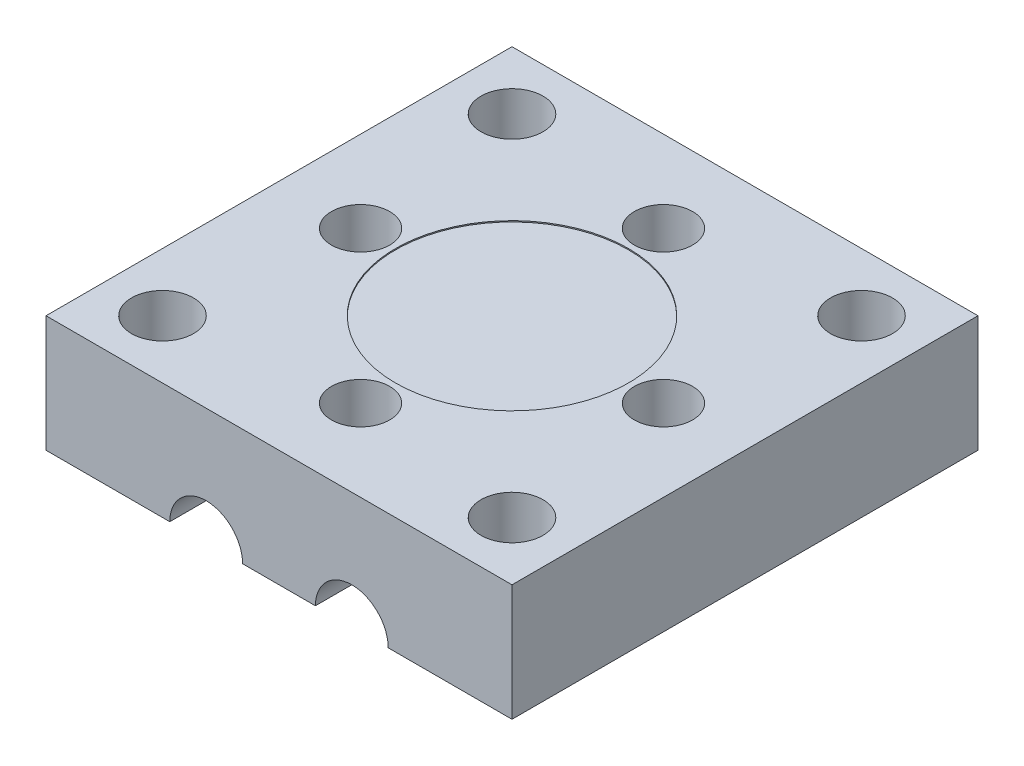
from build123d import *

# Parameters (mm, degrees)
SKETCH1_W               = 50.8
SKETCH1_H               = 50.8
BOSS_EXTRUDE1_DEPTH     = 12.7
SKETCH2_R               = 3.96875
CUT_EXTRUDE1_DEPTH      = 59.198711326
F_1_4_CLEARANCE_HOLE1_D = 6.7564
SKETCH7_R               = 3.175
CUT_EXTRUDE2_DEPTH      = 6.35
F_6_CLEARANCE_HOLE1_D   = 3.7973
CUT_EXTRUDE5_START      = -1.5875
SKETCH15_R              = 3.175
CUT_EXTRUDE5_DEPTH      = 1.5875
SKETCH16_R              = 12.7
CUT_EXTRUDE6_DEPTH      = 0.127


with BuildPart() as part:
    # Sketch1 → Boss-Extrude1 (new body)
    with BuildSketch(Plane(origin=(0, 0, 0), x_dir=(1, 0, 0), z_dir=(0, 1, 0))):
        Rectangle(SKETCH1_W, SKETCH1_H)
    extrude(amount=BOSS_EXTRUDE1_DEPTH)

    # Sketch2 → Cut-Extrude1 (cut, through all)
    with BuildSketch(Plane.XY.offset(25.4)):
        with Locations((-7.9375, 0)):
            Circle(SKETCH2_R)
        with Locations((7.9375, 0)):
            Circle(SKETCH2_R)
    extrude(amount=-CUT_EXTRUDE1_DEPTH, mode=Mode.SUBTRACT)

    # 1/4 Clearance Hole1 (through all)
    with Locations(Plane(origin=(0, 12.7, 0), x_dir=(1, 0, 0), z_dir=(0, 1, 0))):
        with Locations((-19.05, -19.05), (-19.05, 19.05), (19.05, 19.05), (19.05, -19.05)):
            Hole(F_1_4_CLEARANCE_HOLE1_D / 2)

    # Sketch7 → Cut-Extrude2 (cut)
    with BuildSketch(Plane(origin=(0, 12.7, 0), x_dir=(1, 0, 0), z_dir=(0, 1, 0))):
        with Locations(Location((-16.51, 0, 0), (0, 0, 270))):
            Circle(SKETCH7_R)
        with Locations(Location((0, 16.51, 0), (0, 0, 270))):
            Circle(SKETCH7_R)
        with Locations(Location((16.51, 0, 0), (0, 0, 270))):
            Circle(SKETCH7_R)
        with Locations(Location((0, -16.51, 0), (0, 0, 270))):
            Circle(SKETCH7_R)
    extrude(amount=-CUT_EXTRUDE2_DEPTH, mode=Mode.SUBTRACT)

    # #6 Clearance Hole1 (through all)
    with Locations(Plane(origin=(0, 6.35, 0), x_dir=(1, 0, 0), z_dir=(0, 1, 0))):
        with Locations((-16.51, 0), (0, 16.51), (16.51, 0), (0, -16.51)):
            Hole(F_6_CLEARANCE_HOLE1_D / 2)

    # Sketch15 → Cut-Extrude5 (cut)
    with BuildSketch(Plane.XZ.offset(CUT_EXTRUDE5_START)):
        with Locations(Location((0, 16.51, 0), (0, 0, 90))):
            Circle(SKETCH15_R)
        with Locations(Location((16.51, 0, 0), (0, 0, 90))):
            Circle(SKETCH15_R)
        with Locations(Location((0, -16.51, 0), (0, 0, 90))):
            Circle(SKETCH15_R)
        with Locations(Location((-16.51, 0, 0), (0, 0, 90))):
            Circle(SKETCH15_R)
    extrude(amount=CUT_EXTRUDE5_DEPTH, mode=Mode.SUBTRACT)

    # Sketch16 → Cut-Extrude6 (cut)
    with BuildSketch(Plane(origin=(0, 12.7, 0), x_dir=(1, 0, 0), z_dir=(0, 1, 0))):
        with Locations(Location((0, 0, 0), (0, 0, 270))):
            Circle(SKETCH16_R)
    extrude(amount=-CUT_EXTRUDE6_DEPTH, mode=Mode.SUBTRACT)


solid = part.part
